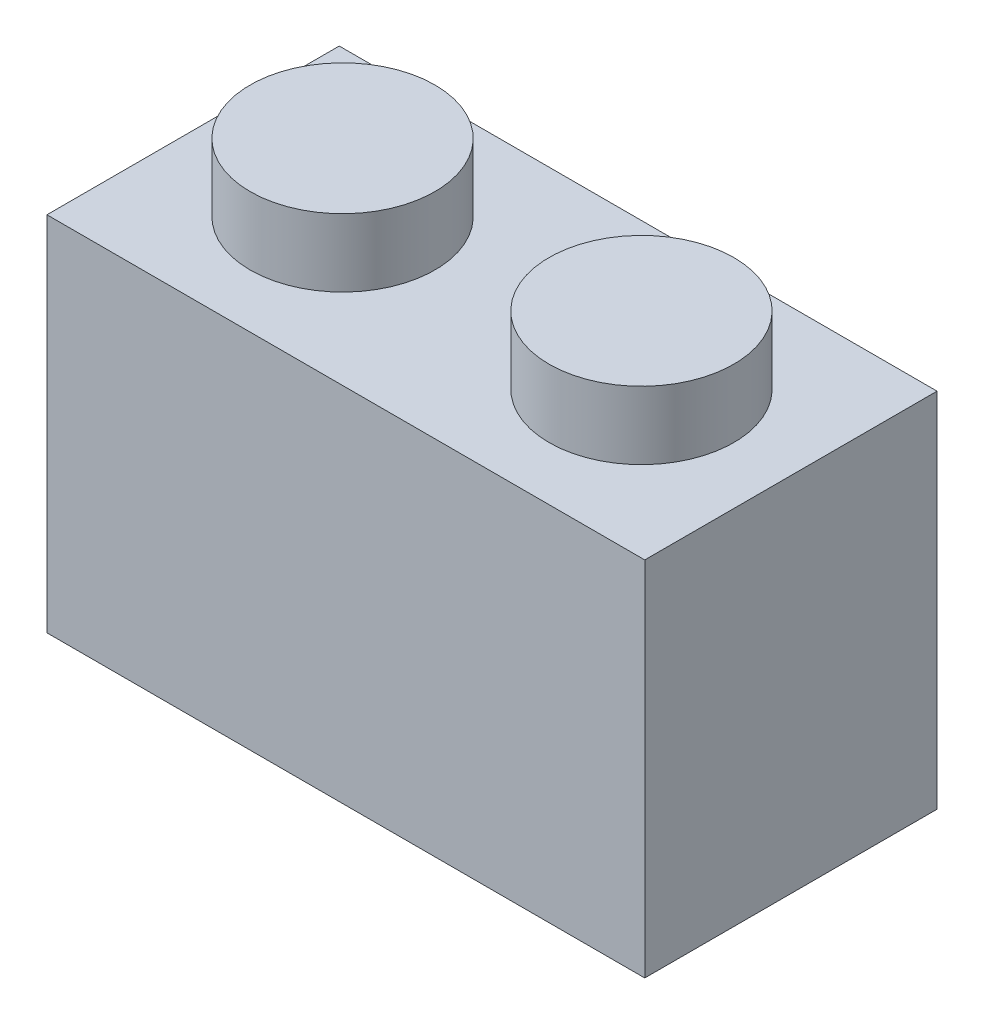
from build123d import *

# Parameters (mm, degrees)
SKETCH1_W           = 15.85
SKETCH1_H           = 7.75
BOSS_EXTRUDE1_DEPTH = 9.6
SKETCH2_R           = 2.45
BOSS_EXTRUDE2_DEPTH = 1.8
SHELL1_T            = -1.5
SKETCH3_R           = 1.5
BOSS_EXTRUDE3_DEPTH = 7.9


with BuildPart() as part:
    # Sketch1 → Boss-Extrude1 (new body)
    with BuildSketch(Plane(origin=(0, 0, 0), x_dir=(1, 0, 0), z_dir=(0, 1, 0))):
        Rectangle(SKETCH1_W, SKETCH1_H)
    extrude(amount=-BOSS_EXTRUDE1_DEPTH)

    # Sketch2 → Boss-Extrude2 (add)
    with BuildSketch(Plane(origin=(0, 0, 0), x_dir=(1, 0, 0), z_dir=(0, 1, 0))):
        with Locations(Location((-3.9625, 0, 0), (0, 0, 270))):
            Circle(SKETCH2_R)
        with Locations(Location((3.9625, 0, 0), (0, 0, 270))):
            Circle(SKETCH2_R)
    extrude(amount=BOSS_EXTRUDE2_DEPTH)

    # Shell1
    shell1_openings = [part.faces().sort_by_distance(p)[0] for p in [
        (0, -9.6, 0),
    ]]
    offset(amount=SHELL1_T, openings=shell1_openings, kind=Kind.INTERSECTION)

    # Sketch3 → Boss-Extrude3 (add)
    with BuildSketch(Plane.XZ.offset(1.5)):
        with Locations(Location((0, 0, 0), (0, 0, 90))):
            Circle(SKETCH3_R)
    extrude(amount=BOSS_EXTRUDE3_DEPTH)


solid = part.part
